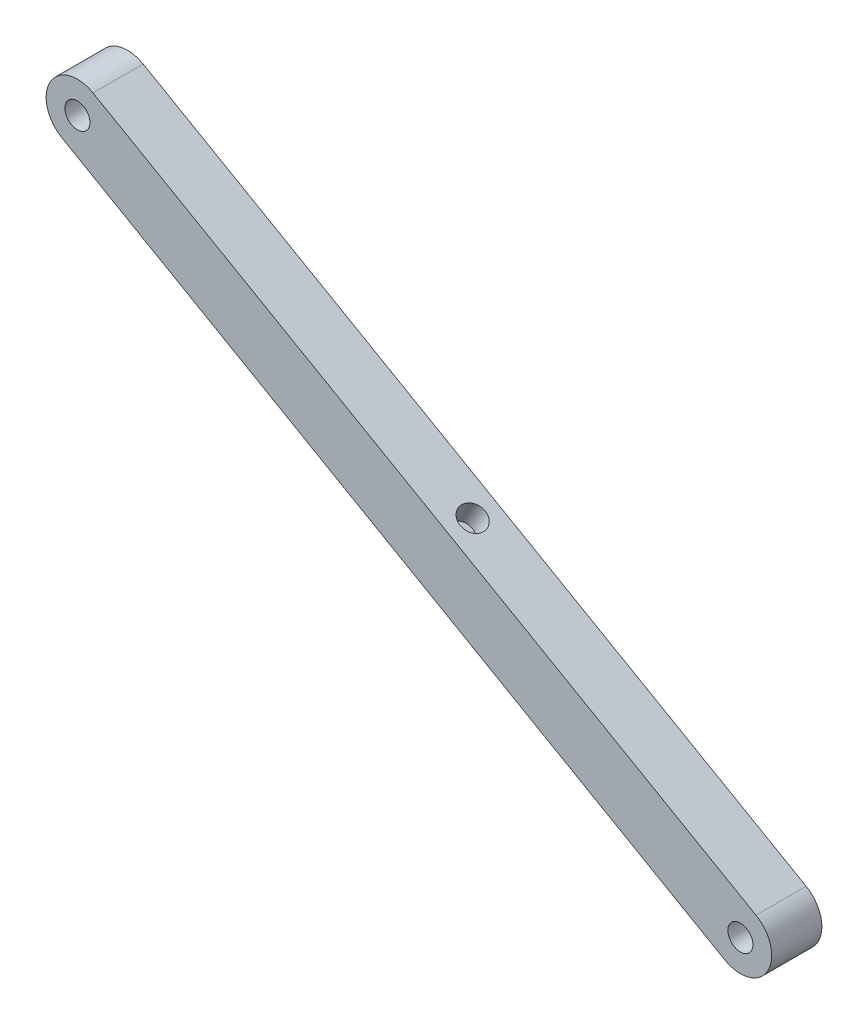
from build123d import *

# Parameters (mm, degrees)
SKETCH1_R           = 1
BOSS_EXTRUDE1_DEPTH = 4
SKETCH2_R           = 1
CUT_EXTRUDE1_DEPTH  = 2


with BuildPart() as part:
    # Sketch1 → Boss-Extrude1 (new body)
    with BuildSketch(Plane.XY):
        with BuildLine():
            Line((-56.923893132, 63.580869991), (-4.020390364, 33.212804613))
            ThreePointArc((-4.020390364, 33.212804613), (-3.096806864, 29.800035426), (-6.509576051, 28.876451927))
            Line((-6.509576051, 28.876451927), (-59.413078819, 59.244517306))
            ThreePointArc((-59.413078819, 59.244517306), (-60.336662318, 62.657286492), (-56.923893132, 63.580869991))
        make_face()
        with Locations((-58.168485975, 61.412693649)):
            Circle(SKETCH1_R, mode=Mode.SUBTRACT)
        with Locations((-5.264983207, 31.04462827)):
            Circle(SKETCH1_R, mode=Mode.SUBTRACT)
    extrude(amount=BOSS_EXTRUDE1_DEPTH)

    # Sketch2 → Cut-Extrude1 (cut)
    with BuildSketch(Plane(origin=(13.343522454, 23.245441166, 0), x_dir=(0.8672705371832455, -0.49783713735908147, 0), z_dir=(0.49783713735908147, 0.8672705371832455, 0))):
        with Locations(Location((-48.403705156, -2, 0), (0, 0, 180))):
            Circle(SKETCH2_R)
    extrude(amount=-CUT_EXTRUDE1_DEPTH, mode=Mode.SUBTRACT)


solid = part.part
